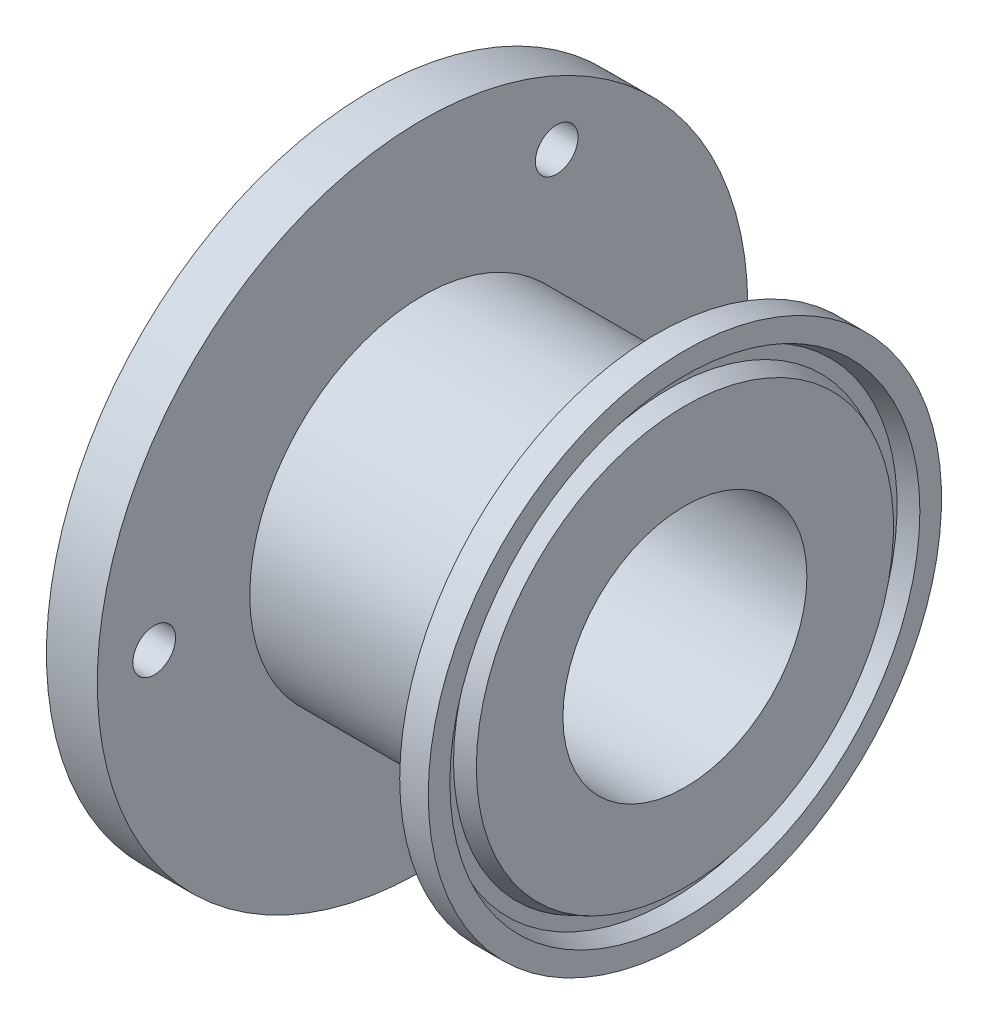
from build123d import *

# Parameters (mm, degrees)
M5_TAPPED_HOLE1_D       = 4.2
M5_TAPPED_HOLE1_DEPTH   = 12.4
M5_TAPPED_HOLE1_TIP     = 1.2618073
SKETCH5_R               = 42
SKETCH5_R_2             = 32
CUT_EXTRUDE_THIN1_DEPTH = 55.572226802


with BuildPart() as part:
    # Sketch1 → Revolve1 (revolve)
    with BuildSketch(Plane.XY):
        with BuildLine():
            Line((-15.404727216, 12), (-15.404727216, 34))
            Line((-15.404727216, 34), (-10.404727216, 34))
            Line((-10.404727216, 34), (-10.404727216, 17))
            Line((-10.404727216, 17), (8.794935567, 17))
            ThreePointArc((8.794935567, 17), (9.450533434, 17.206709213), (9.869004233, 17.752070976))
            Line((9.869004233, 17.752070976), (12.598027216, 25.25))
            Line((12.598027216, 25.25), (15.404727216, 25.25))
            Line((15.404727216, 25.25), (15.404727216, 23.1186))
            Line((15.404727216, 23.1186), (13.829927216, 22.450137059))
            Line((13.829927216, 22.450137059), (13.829927216, 21.187062941))
            Line((13.829927216, 21.187062941), (15.404727216, 20.5186))
            Line((15.404727216, 20.5186), (15.404727216, 12))
            Line((15.404727216, 12), (-15.404727216, 12))
        make_face()
    revolve(axis=Axis((0, 0, 0), (1, 0, 0)))

    # M5 Tapped Hole1
    with Locations(Plane.ZY.offset(15.404727216)):
        with Locations((-13.199999999, -22.86307066), (-13.200000001, 22.863070659), (26.4, 1e-09)):
            Hole(M5_TAPPED_HOLE1_D / 2, depth=M5_TAPPED_HOLE1_DEPTH)
            with Locations((0, 0, -(M5_TAPPED_HOLE1_DEPTH + M5_TAPPED_HOLE1_TIP / 2))):  # 118° drill point
                Cone(0, M5_TAPPED_HOLE1_D / 2, M5_TAPPED_HOLE1_TIP, mode=Mode.SUBTRACT)

    # Sketch5 → Cut-Extrude-Thin1 (cut, through all)
    with BuildSketch(Plane(origin=(-10.404727216, 0, 0), x_dir=(0, 0, -1), z_dir=(1, 0, 0))):
        Circle(SKETCH5_R)
        Circle(SKETCH5_R_2, mode=Mode.SUBTRACT)
    extrude(amount=-CUT_EXTRUDE_THIN1_DEPTH, mode=Mode.SUBTRACT)


solid = part.part
